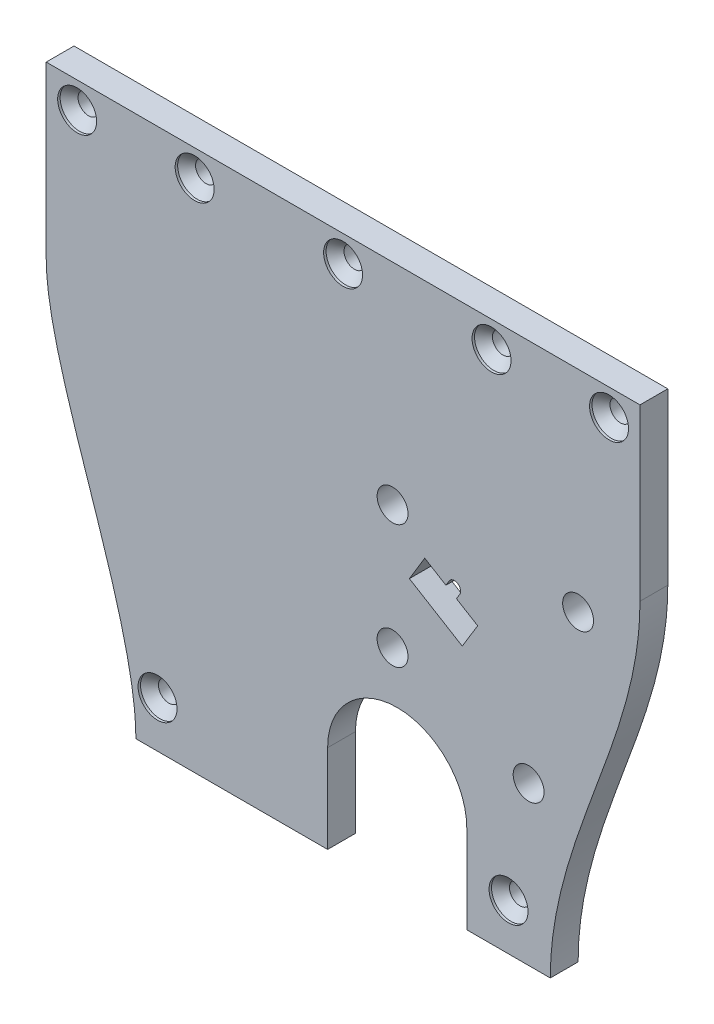
from build123d import *

# Parameters (mm, degrees)
SKETCH1_R                                    = 1.5
BOSS_EXTRUDE1_DEPTH                          = 4.5
SKETCH2_R                                    = 2.5
CUT_EXTRUDE1_DEPTH                           = 130.97115079
SKETCH3_R                                    = 1
CUT_EXTRUDE2_DEPTH                           = 130.97115079
CUT_EXTRUDE3_DEPTH                           = 130.97115079
CSK_FOR_M3_COUNTERSUNK_FLAT_HEAD_SCR_2_COUNT = 2
CSK_FOR_M3_COUNTERSUNK_FLAT_HEAD_SCR_2_PITCH = 19
CSK_FOR_M3_COUNTERSUNK_FLAT_HEAD_SCR_3_COUNT = 2
CSK_FOR_M3_COUNTERSUNK_FLAT_HEAD_SCR_3_PITCH = 43
CSK_FOR_M3_COUNTERSUNK_FLAT_HEAD_SCR_4_COUNT = 2
CSK_FOR_M3_COUNTERSUNK_FLAT_HEAD_SCR_4_PITCH = 67
CSK_FOR_M3_COUNTERSUNK_FLAT_HEAD_SCR_5_COUNT = 2
CSK_FOR_M3_COUNTERSUNK_FLAT_HEAD_SCR_5_PITCH = 86
CSK_FOR_M3_COUNTERSUNK_FLAT_HEAD_SCR_6_COUNT = 2
CSK_FOR_M3_COUNTERSUNK_FLAT_HEAD_SCR_6_PITCH = 102.971476633
CSK_FOR_M3_COUNTERSUNK_FLAT_HEAD_SCR_7_COUNT = 2
CSK_FOR_M3_COUNTERSUNK_FLAT_HEAD_SCR_7_PITCH = 76.857416688


with BuildPart() as part:
    # Sketch1 → Boss-Extrude1 (new body)
    with BuildSketch(Plane.XY):
        with BuildLine():
            Line((-96, 87.5), (0, 87.5))
            Line((0, 87.5), (0, 60))
            add(Edge.make_bspline(
                [(0, 60), (0, 47.440932757), (-8.740761153, 28.351955076), (-14.5, 8.088351659), (-14.5, 0)],
                knots=[0, 0, 0, 0, 0.602811114, 1, 1, 1, 1], degree=3))
            Line((-14.5, 0), (-28, 0))
            Line((-28, 0), (-28, 14.25))
            ThreePointArc((-28, 14.25), (-39.25, 25.5), (-50.5, 14.25))
            Line((-50.5, 14.25), (-50.5, 0))
            Line((-50.5, 0), (-81.5, 0))
            add(Edge.make_bspline(
                [(-96, 60), (-96, 44.479329369), (-81.5, 17.438131956), (-81.5, 0)],
                knots=[0, 0, 0, 0, 1, 1, 1, 1], degree=3))
            Line((-96, 60), (-96, 87.5))
        make_face()
        with Locations((-91, 83.25)):
            Circle(SKETCH1_R, mode=Mode.SUBTRACT)
        with Locations((-72, 83.25)):
            Circle(SKETCH1_R, mode=Mode.SUBTRACT)
        with Locations((-48, 83.25)):
            Circle(SKETCH1_R, mode=Mode.SUBTRACT)
        with Locations((-5, 83.25)):
            Circle(SKETCH1_R, mode=Mode.SUBTRACT)
        with Locations((-24, 83.25)):
            Circle(SKETCH1_R, mode=Mode.SUBTRACT)
        with Locations((-21.25, 7.5)):
            Circle(SKETCH1_R, mode=Mode.SUBTRACT)
        with Locations((-78, 7.5)):
            Circle(SKETCH1_R, mode=Mode.SUBTRACT)
    extrude(amount=BOSS_EXTRUDE1_DEPTH)

    # Sketch2 → Cut-Extrude1 (cut, through all)
    with BuildSketch(Plane.XY.offset(4.5)):
        with Locations((-10, 53.5)):
            Circle(SKETCH2_R)
        with Locations((-40, 53.5)):
            Circle(SKETCH2_R)
        with Locations((-40, 33.5)):
            Circle(SKETCH2_R)
        with Locations((-18, 25.5)):
            Circle(SKETCH2_R)
    extrude(amount=-CUT_EXTRUDE1_DEPTH, mode=Mode.SUBTRACT)

    # Sketch3 → Cut-Extrude2 (cut, through all)
    with BuildSketch(Plane.XY.offset(4.5)):
        with Locations((-30.001125718, 46.899563619)):
            Circle(SKETCH3_R)
    extrude(amount=-CUT_EXTRUDE2_DEPTH, mode=Mode.SUBTRACT)

    # Sketch4 → Cut-Extrude3 (cut, through all)
    with BuildSketch(Plane(origin=(0, 0, 0), x_dir=(-1, 0, 0), z_dir=(0, 0, -1))):
        with BuildLine():
            Line((28.728353494, 39.348401399), (37.282344284, 44.528096521))
            Line((37.282344284, 44.528096521), (34.796090626, 48.634012101))
            Line((34.796090626, 48.634012101), (31.37449431, 46.562134052))
            Line((31.37449431, 46.562134052), (30.856524797, 47.417533131))
            ThreePointArc((30.856524797, 47.417533131), (29.500195325, 47.765051192), (29.125889015, 46.415868763))
            Line((29.125889015, 46.415868763), (29.664366906, 45.526601189))
            Line((29.664366906, 45.526601189), (26.242099835, 43.454316978))
            Line((26.242099835, 43.454316978), (28.728353494, 39.348401399))
        make_face()
    extrude(amount=-CUT_EXTRUDE3_DEPTH, mode=Mode.SUBTRACT)

    # Sketch6 → CSK for M3 Countersunk Flat Head Screw1 (revolve, cut)
    with BuildSketch(Plane(origin=(-91, 83.25, 4.5), x_dir=(0, -1, 0), z_dir=(1, 0, 0))):
        Polygon((0, 0), (0, 4.5), (1.7, 4.5), (1.7, 1.85), (3.15, 0.4), (3.15, 0), align=None)
    csk_for_m3_countersunk_flat_head_screw1 = revolve(axis=Axis((-91, 83.25, 10.85), (0, 0, -1)), mode=Mode.SUBTRACT)

    # CSK for M3 Countersunk Flat Head Scr 2: CSK for M3 Countersunk Flat Head Screw1 ×2
    with Locations(*[(i * CSK_FOR_M3_COUNTERSUNK_FLAT_HEAD_SCR_2_PITCH, 0, 0) for i in range(1, CSK_FOR_M3_COUNTERSUNK_FLAT_HEAD_SCR_2_COUNT)]):
        add(csk_for_m3_countersunk_flat_head_screw1, mode=Mode.SUBTRACT)

    # CSK for M3 Countersunk Flat Head Scr 3: CSK for M3 Countersunk Flat Head Screw1 ×2
    with Locations(*[(i * CSK_FOR_M3_COUNTERSUNK_FLAT_HEAD_SCR_3_PITCH, 0, 0) for i in range(1, CSK_FOR_M3_COUNTERSUNK_FLAT_HEAD_SCR_3_COUNT)]):
        add(csk_for_m3_countersunk_flat_head_screw1, mode=Mode.SUBTRACT)

    # CSK for M3 Countersunk Flat Head Scr 4: CSK for M3 Countersunk Flat Head Screw1 ×2
    with Locations(*[(i * CSK_FOR_M3_COUNTERSUNK_FLAT_HEAD_SCR_4_PITCH, 0, 0) for i in range(1, CSK_FOR_M3_COUNTERSUNK_FLAT_HEAD_SCR_4_COUNT)]):
        add(csk_for_m3_countersunk_flat_head_screw1, mode=Mode.SUBTRACT)

    # CSK for M3 Countersunk Flat Head Scr 5: CSK for M3 Countersunk Flat Head Screw1 ×2
    with Locations(*[(i * CSK_FOR_M3_COUNTERSUNK_FLAT_HEAD_SCR_5_PITCH, 0, 0) for i in range(1, CSK_FOR_M3_COUNTERSUNK_FLAT_HEAD_SCR_5_COUNT)]):
        add(csk_for_m3_countersunk_flat_head_screw1, mode=Mode.SUBTRACT)

    # CSK for M3 Countersunk Flat Head Scr 6: CSK for M3 Countersunk Flat Head Screw1 ×2
    with Locations(*[Vector(0.6773720478781835, -0.7356406111365222, 0) * (i * CSK_FOR_M3_COUNTERSUNK_FLAT_HEAD_SCR_6_PITCH) for i in range(1, CSK_FOR_M3_COUNTERSUNK_FLAT_HEAD_SCR_6_COUNT)]):
        add(csk_for_m3_countersunk_flat_head_screw1, mode=Mode.SUBTRACT)

    # CSK for M3 Countersunk Flat Head Scr 7: CSK for M3 Countersunk Flat Head Screw1 ×2
    with Locations(*[Vector(0.1691443787750649, -0.9855912840162485, 0) * (i * CSK_FOR_M3_COUNTERSUNK_FLAT_HEAD_SCR_7_PITCH) for i in range(1, CSK_FOR_M3_COUNTERSUNK_FLAT_HEAD_SCR_7_COUNT)]):
        add(csk_for_m3_countersunk_flat_head_screw1, mode=Mode.SUBTRACT)


solid = part.part
